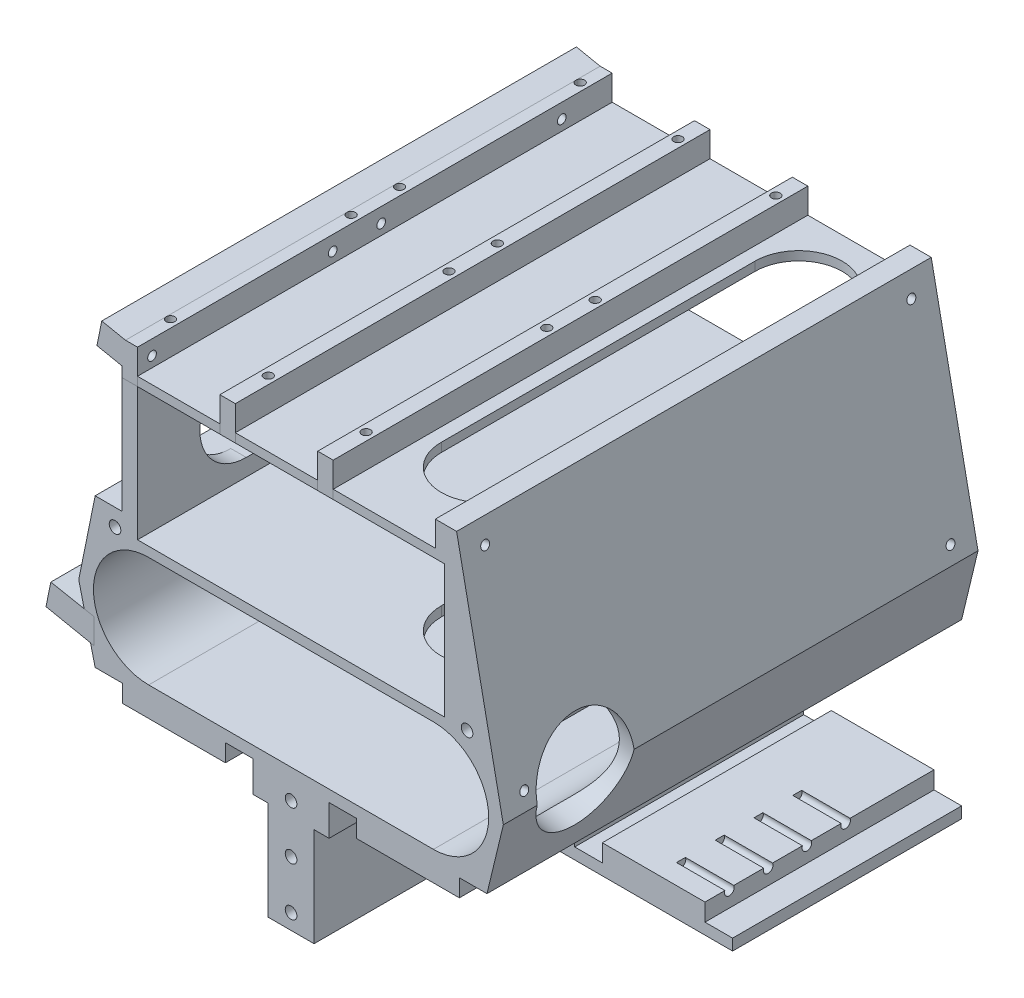
from build123d import *

# Parameters (mm, degrees)
ESQUISSE1_W                  = 112.172532808
ESQUISSE1_H                  = 92.061088164
BOSS_EXTRU_1_DEPTH           = 98
ESQUISSE2_W                  = 63.4
ESQUISSE2_H                  = 27.4
ENL_V_MAT_EXTRU_1_DEPTH      = 122.93637795
ENL_V_MAT_EXTRU_2_DEPTH      = 122.93637795
ENL_V_MAT_EXTRU_3_DEPTH      = 122.93637795
ESQUISSE8_R                  = 1.2
ENL_V_MAT_EXTRU_5_DEPTH      = 122.93637795
ESQUISSE9_R                  = 1
ENL_V_MAT_EXTRU_6_DEPTH      = 10
ENL_V_START                  = -10
ESQUISSE10_R                 = 1
ENL_V_MAT_EXTRU_7_DEPTH      = 10
ENL_V_MAT_EXTRU_8_DEPTH      = 44
ENL_V_MAT_EXTRU_8_DEPTH_BACK = 54
ESQUISSE11_W                 = 46.711897879
ESQUISSE11_H                 = 15.553538148
ESQUISSE12_R                 = 1.2
ENL_V_MAT_EXTRU_9_DEPTH      = 15
ENL_V_MAT_EXTRU_10_DEPTH     = 36
BOSS_EXTRU_2_DEPTH           = 98
ESQUISSE15_R                 = 0.9
ENL_V_MAT_EXTRU_11_DEPTH     = 5
ENL_V_MAT_EXTRU_13_DEPTH     = 33
ESQUISSE18_R                 = 10
ENL_V_MAT_EXTRU_14_DEPTH     = 7
ESQUISSE19_W                 = 3.20419829
ESQUISSE19_H                 = 7.04643077
ESQUISSE19_W_2               = 3.2
BOSS_EXTRU_3_DEPTH           = 98
ESQUISSE20_R                 = 0.9
ENL_V_MAT_EXTRU_15_DEPTH     = 8
BOSS_EXTRU_4_DEPTH           = 98
ESQUISSE22_R                 = 0.9
ENL_V_MAT_EXTRU_16_DEPTH     = 9
ENL_V_MAT_EXTRU_17_REACH     = 149.713
ESQUISSE23_W                 = 85.310819732
ESQUISSE23_H                 = 4


with BuildPart() as part:
    # Esquisse1 → Boss.-Extru.1 (new body)
    with BuildSketch(Plane.XY):
        Rectangle(ESQUISSE1_W, ESQUISSE1_H)
    extrude(amount=BOSS_EXTRU_1_DEPTH)

    # Esquisse2 → Enlèv. mat.-Extru.1 (cut, through all)
    with BuildSketch(Plane.XY.offset(98)):
        with Locations((0, 30.491247921)):
            Rectangle(ESQUISSE2_W, ESQUISSE2_H)
    extrude(amount=-ENL_V_MAT_EXTRU_1_DEPTH, mode=Mode.SUBTRACT)

    # Esquisse3 → Enlèv. mat.-Extru.2 (cut, through all)
    with BuildSketch(Plane.XY.offset(98)):
        with BuildLine():
            Line((-29.4, 14.791247921), (29.4, 14.791247921))
            ThreePointArc((29.4, 14.791247921), (40.8, 3.391247921), (29.4, -8.008752079))
            Line((29.4, -8.008752079), (-29.4, -8.008752079))
            ThreePointArc((-29.4, -8.008752079), (-40.8, 3.391247921), (-29.4, 14.791247921))
        make_face()
    extrude(amount=-ENL_V_MAT_EXTRU_2_DEPTH, mode=Mode.SUBTRACT)

    # Esquisse4 → Enlèv. mat.-Extru.3 (cut, through all)
    with BuildSketch(Plane.XY.offset(98)):
        Polygon((-13.55, -10.408752079), (-13.55, -14.008752079), (-34.75, -14.008752079), (-34.75, -10.408752079), (-40.45, -10.408752079), (-40.45, -15.408530837), (-46.470069851, -15.408530837), (-46.470069851, -38.70897332), (-40.45, -38.70897332), (-40.45, -43.708752079), (-34.75, -43.708752079), (-34.75, -40.108752079), (-13.55, -40.108752079), (-13.55, -43.708752079), (-7.85, -43.708752079), (-7.85, -37.308752079), (-4.75, -37.308752079), (-4.75, -16.808752079), (-7.85, -16.808752079), (-7.85, -10.408752079), align=None)
        Polygon((40.45, -10.408752079), (40.45, -15.408530837), (46.470069851, -15.408530837), (46.470069851, -38.70897332), (40.45, -38.70897332), (40.45, -43.708752079), (34.75, -43.708752079), (34.75, -40.108752079), (13.55, -40.108752079), (13.55, -43.708752079), (7.85, -43.708752079), (7.85, -37.308752079), (4.75, -37.308752079), (4.75, -16.808752079), (7.85, -16.808752079), (7.85, -10.408752079), (13.55, -10.408752079), (13.55, -14.008752079), (34.75, -14.008752079), (34.75, -10.408752079), align=None)
    extrude(amount=-ENL_V_MAT_EXTRU_3_DEPTH, mode=Mode.SUBTRACT)

    # Esquisse8 → Enlèv. mat.-Extru.5 (cut, through all)
    with BuildSketch(Plane(origin=(0, 0, 0), x_dir=(-1, 0, 0), z_dir=(0, 0, -1))):
        with Locations((36.342435472, 16.729092577)):
            Circle(ESQUISSE8_R)
        with Locations(Location((-36.342435472, 16.729092577, 0), (0, 0, 180))):
            Circle(ESQUISSE8_R)
        with Locations((0, -24.030544082)):
            Circle(ESQUISSE8_R)
        with Locations((0, -34.030544082)):
            Circle(ESQUISSE8_R)
        with Locations((0, -14.030544082)):
            Circle(ESQUISSE8_R)
        Polygon((40.45, -46.030544082), (40.45, -10.408752079), (43.831541667, 3.591247921), (40.45, 20.287049631), (34.90419829, 20.287049631), (34.90419829, 46.030544082), (56.086266404, 46.030544082), (56.086266404, -46.030544082), align=None)
        Polygon((-40.45, -46.030544082), (-40.45, -10.408752079), (-43.831541667, 3.591247921), (-40.45, 20.287049631), (-35.235952742, 46.030544082), (-56.086266404, 46.030544082), (-56.086266404, -46.030544082), align=None)
    extrude(amount=-ENL_V_MAT_EXTRU_5_DEPTH, mode=Mode.SUBTRACT)

    # Esquisse9 → Enlèv. mat.-Extru.6 (cut)
    with BuildSketch(Plane.ZY.offset(34.75)):
        with Locations((18.25, -13.508752079)):
            Circle(ESQUISSE9_R)
        with Locations((26.25, -13.508752079)):
            Circle(ESQUISSE9_R)
        with Locations((34.25, -13.508752079)):
            Circle(ESQUISSE9_R)
        with Locations((42.25, -13.508752079)):
            Circle(ESQUISSE9_R)
        with Locations((18.25, -40.508752079)):
            Circle(ESQUISSE9_R)
        with Locations((26.25, -40.508752079)):
            Circle(ESQUISSE9_R)
        with Locations((34.25, -40.508752079)):
            Circle(ESQUISSE9_R)
        with Locations((42.25, -40.508752079)):
            Circle(ESQUISSE9_R)
    extrude(amount=-ENL_V_MAT_EXTRU_6_DEPTH, mode=Mode.SUBTRACT)

    # Esquisse10 → Enlèv. mat.-Extru.7 (cut)
    with BuildSketch(Plane(origin=(34.75, 0, 0), x_dir=(0, 0, -1), z_dir=(1, 0, 0)).offset(ENL_V_START)):
        with Locations((-42.25, -13.508752079)):
            Circle(ESQUISSE10_R)
        with Locations((-34.25, -13.508752079)):
            Circle(ESQUISSE10_R)
        with Locations((-26.25, -13.508752079)):
            Circle(ESQUISSE10_R)
        with Locations((-18.25, -13.508752079)):
            Circle(ESQUISSE10_R)
        with Locations((-18.25, -40.508752079)):
            Circle(ESQUISSE10_R)
        with Locations((-26.25, -40.508752079)):
            Circle(ESQUISSE10_R)
        with Locations((-34.25, -40.508752079)):
            Circle(ESQUISSE10_R)
        with Locations((-42.25, -40.508752079)):
            Circle(ESQUISSE10_R)
    extrude(amount=ENL_V_MAT_EXTRU_7_DEPTH, mode=Mode.SUBTRACT)

    # Esquisse11 → Enlèv. mat.-Extru.8 (cut, two sides: drawn at the far end of the back side and taken through both)
    with BuildSketch(Plane.ZY.offset(4.75).offset(-ENL_V_MAT_EXTRU_8_DEPTH_BACK)):
        with Locations((74.644051061, -44.986640068)):
            Rectangle(ESQUISSE11_W, ESQUISSE11_H)
    extrude(amount=ENL_V_MAT_EXTRU_8_DEPTH + ENL_V_MAT_EXTRU_8_DEPTH_BACK, mode=Mode.SUBTRACT)

    # Esquisse12 → Enlèv. mat.-Extru.9 (cut)
    with BuildSketch(Plane.XZ.offset(37.209870994)):
        with Locations((0, 91.988102121)):
            Circle(ESQUISSE12_R)
        with Locations((0, 53.288102121)):
            Circle(ESQUISSE12_R)
    extrude(amount=-ENL_V_MAT_EXTRU_9_DEPTH, mode=Mode.SUBTRACT)

    # Esquisse13 → Enlèv. mat.-Extru.10 (cut)
    with BuildSketch(Plane(origin=(0, 46.030544082, 0), x_dir=(1, 0, 0), z_dir=(0, 1, 0))):
        with BuildLine():
            Line((29.401511347, -13.631097944), (29.401511347, -78.444504203))
            ThreePointArc((29.401511347, -78.444504203), (20.430009822, -87.416005728), (11.458508297, -78.444504203))
            Line((11.458508297, -78.444504203), (11.458508297, -13.631097944))
            ThreePointArc((11.458508297, -13.631097944), (20.430009822, -4.659596419), (29.401511347, -13.631097944))
        make_face()
    extrude(amount=-ENL_V_MAT_EXTRU_10_DEPTH, mode=Mode.SUBTRACT)

    # Esquisse14 → Boss.-Extru.2 (add, through all)
    with BuildSketch(Plane(origin=(0, 0, 0), x_dir=(-1, 0, 0), z_dir=(0, 0, -1))):
        Polygon((-35.235952742, 46.030544082), (-34.181307811, 51.237678691), (-29.786849485, 51.237678691), (-29.786849485, 46.030544082), align=None)
    extrude(amount=-BOSS_EXTRU_2_DEPTH)

    # Esquisse15 → Enlèv. mat.-Extru.11 (cut)
    with BuildSketch(Plane(origin=(42.803048455, 8.669262748, 0), x_dir=(0, 0, -1), z_dir=(0.980099310455717, 0.19850778736419453, 0))):
        with Locations(Location((-5.012556966, -1.831122741, 0), (0, 0, 90))):
            Circle(ESQUISSE15_R)
        with Locations(Location((-5.012556966, 38.868877259, 0), (0, 0, 90))):
            Circle(ESQUISSE15_R)
        with Locations(Location((-93.012556966, -1.831122741, 0), (0, 0, 90))):
            Circle(ESQUISSE15_R)
        with Locations(Location((-93.012556966, 38.868877259, 0), (0, 0, 90))):
            Circle(ESQUISSE15_R)
    extrude(amount=-ENL_V_MAT_EXTRU_11_DEPTH, mode=Mode.SUBTRACT)

    # Esquisse17 → Enlèv. mat.-Extru.13 (cut)
    with BuildSketch(Plane.ZY.offset(34.90419829)):
        with BuildLine():
            Line((11.891222977, 39.441182616), (75.540539517, 39.441182616))
            ThreePointArc((75.540539517, 39.441182616), (85.11760601, 29.864116124), (75.540539517, 20.287049631))
            Line((75.540539517, 20.287049631), (11.891222977, 20.287049631))
            ThreePointArc((11.891222977, 20.287049631), (2.314156484, 29.864116124), (11.891222977, 39.441182616))
        make_face()
    extrude(amount=-ENL_V_MAT_EXTRU_13_DEPTH, mode=Mode.SUBTRACT)

    # Esquisse18 → Enlèv. mat.-Extru.14 (cut)
    with BuildSketch(Plane(origin=(40.595723706, -9.805437943, 0), x_dir=(0, 0, -1), z_dir=(0.9720468607360772, -0.23478692581389082, 0))):
        with Locations(Location((-81, 13.78193419, 0), (0, 0, 32.885658468))):
            Circle(ESQUISSE18_R)
    extrude(amount=-ENL_V_MAT_EXTRU_14_DEPTH, mode=Mode.SUBTRACT)

    # Esquisse19 → Boss.-Extru.3 (add, through all)
    with BuildSketch(Plane(origin=(0, 0, 0), x_dir=(-1, 0, 0), z_dir=(0, 0, -1))):
        with Locations((33.302099145, 47.714463306)):
            Rectangle(ESQUISSE19_W, ESQUISSE19_H)
        with Locations((13.1, 47.714463306)):
            Rectangle(ESQUISSE19_W_2, ESQUISSE19_H)
        with Locations((-7.1, 47.714463306)):
            Rectangle(ESQUISSE19_W_2, ESQUISSE19_H)
    extrude(amount=-BOSS_EXTRU_3_DEPTH)

    # Esquisse20 → Enlèv. mat.-Extru.15 (cut)
    with BuildSketch(Plane(origin=(0, 51.237678691, 0), x_dir=(1, 0, 0), z_dir=(0, 1, 0))):
        with Locations(Location((-33.302099145, -5, 0), (0, 0, 270))):
            Circle(ESQUISSE20_R)
        with Locations(Location((-33.302099145, -42.3, 0), (0, 0, 270))):
            Circle(ESQUISSE20_R)
        with Locations(Location((-33.302099145, -52.3, 0), (0, 0, 270))):
            Circle(ESQUISSE20_R)
        with Locations(Location((-33.302099145, -89.6, 0), (0, 0, 270))):
            Circle(ESQUISSE20_R)
        with Locations(Location((-13.102099145, -42.3, 0), (0, 0, 270))):
            Circle(ESQUISSE20_R)
        with Locations(Location((-13.102099145, -52.3, 0), (0, 0, 270))):
            Circle(ESQUISSE20_R)
        with Locations(Location((-13.102099145, -89.6, 0), (0, 0, 270))):
            Circle(ESQUISSE20_R)
        with Locations(Location((-13.102099145, -5, 0), (0, 0, 270))):
            Circle(ESQUISSE20_R)
        with Locations(Location((7.097900855, -42.3, 0), (0, 0, 270))):
            Circle(ESQUISSE20_R)
        with Locations(Location((7.097900855, -52.3, 0), (0, 0, 270))):
            Circle(ESQUISSE20_R)
        with Locations(Location((7.097900855, -89.6, 0), (0, 0, 270))):
            Circle(ESQUISSE20_R)
        with Locations(Location((7.097900855, -5, 0), (0, 0, 270))):
            Circle(ESQUISSE20_R)
    extrude(amount=-ENL_V_MAT_EXTRU_15_DEPTH, mode=Mode.SUBTRACT)

    # Esquisse21 → Boss.-Extru.4 (add, through all)
    with BuildSketch(Plane(origin=(0, 0, 0), x_dir=(-1, 0, 0), z_dir=(0, 0, -1))):
        Polygon((49.602717093, 0.284954173), (40.687770172, -1.437135116), (40.687770172, -6.622189129), (50.59525603, -4.615542379), align=None)
        Polygon((39.081804363, 52.230217627), (40.0743433, 47.329721075), (34.181307811, 46.136154848), (34.181307811, 51.237678691), align=None)
    extrude(amount=-BOSS_EXTRU_4_DEPTH)

    # Esquisse22 → Enlèv. mat.-Extru.16 (cut)
    with BuildSketch(Plane(origin=(-47.703545007, 9.661801685, 0), x_dir=(0, 0, 1), z_dir=(-0.9800993104557165, 0.19850778736419672, 0))):
        with Locations(Location((95.00005, 40.932757771, 0), (0, 0, 270))):
            Circle(ESQUISSE22_R)
        with Locations(Location((57.70005, 40.932757771, 0), (0, 0, 270))):
            Circle(ESQUISSE22_R)
        with Locations(Location((95.00005, -12.067242229, 0), (0, 0, 270))):
            Circle(ESQUISSE22_R)
        with Locations(Location((57.70005, -12.067242229, 0), (0, 0, 270))):
            Circle(ESQUISSE22_R)
        with Locations(Location((47.70005, 40.932757771, 0), (0, 0, 270))):
            Circle(ESQUISSE22_R)
        with Locations(Location((10.40005, 40.932757771, 0), (0, 0, 270))):
            Circle(ESQUISSE22_R)
        with Locations(Location((47.70005, -12.067242229, 0), (0, 0, 270))):
            Circle(ESQUISSE22_R)
        with Locations(Location((10.40005, -12.067242229, 0), (0, 0, 270))):
            Circle(ESQUISSE22_R)
    extrude(amount=-ENL_V_MAT_EXTRU_16_DEPTH, mode=Mode.SUBTRACT)

    # Enlèv. mat.-Extru.17: up to this face of the body (flat: up to its plane)
    enl_v_mat_extru_17_end = Plane(part.part.faces().sort_by_distance((0, -37.209870994, 74.685801146))[0])
    # Esquisse23 → Enlèv. mat.-Extru.17 (cut, up to the picked face)
    with BuildSketch(Plane.XZ.offset(46.030544082), mode=Mode.PRIVATE) as enl_v_mat_extru_17_sk1:
        with Locations((-0.351116798, 49.288102121)):
            Rectangle(ESQUISSE23_W, ESQUISSE23_H)
    enl_v_mat_extru_17_tool1 = split(extrude(enl_v_mat_extru_17_sk1.sketch, amount=-ENL_V_MAT_EXTRU_17_REACH, mode=Mode.PRIVATE), bisect_by=enl_v_mat_extru_17_end, keep=Keep.BOTH, mode=Mode.PRIVATE)
    add(enl_v_mat_extru_17_tool1.solids().sort_by(Axis((-0.351117, -46.030544, 49.288102), (0, 1, 0)))[0], mode=Mode.SUBTRACT)


solid = part.part
